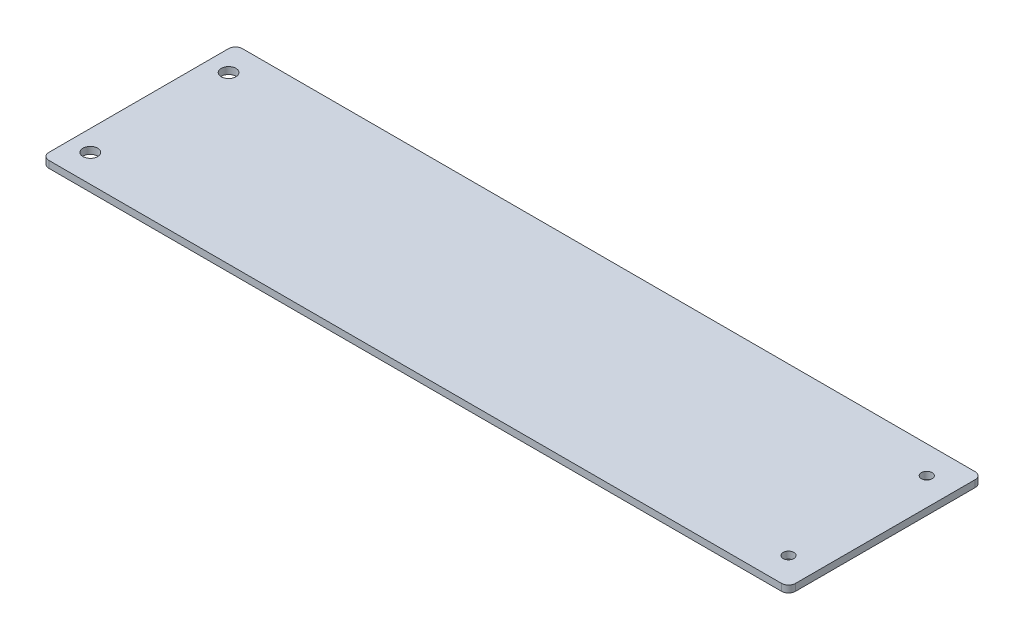
from build123d import *

# Parameters (mm, degrees)
SKETCH1_W                        = 342.9
SKETCH1_H                        = 88.9
BOSS_EXTRUDE1_DEPTH              = 3.175
F_17_64_0_26563_DIAMETER_HOLE1_D = 6.747002
F_10_0_1935_DIAMETER_HOLE1_D     = 4.9149
FILLET1_R                        = 3.175


with BuildPart() as part:
    # Sketch1 → Boss-Extrude1 (new body)
    with BuildSketch(Plane(origin=(0, 0, 0), x_dir=(1, 0, 0), z_dir=(0, 1, 0))):
        Rectangle(SKETCH1_W, SKETCH1_H)
    extrude(amount=BOSS_EXTRUDE1_DEPTH)

    # 17/64 (0.26563) Diameter Hole1 (through all)
    with Locations(Plane(origin=(0, 3.175, 0), x_dir=(1, 0, 0), z_dir=(0, 1, 0))):
        with Locations((-161.925, 31.75), (-161.925, -31.75)):
            Hole(F_17_64_0_26563_DIAMETER_HOLE1_D / 2)

    # #10 (0.1935) Diameter Hole1 (through all)
    with Locations(Plane(origin=(0, 3.175, 0), x_dir=(1, 0, 0), z_dir=(0, 1, 0))):
        with Locations((158.75, 31.75), (158.75, -31.75)):
            Hole(F_10_0_1935_DIAMETER_HOLE1_D / 2)

    # Fillet1
    fillet1_edges = [part.edges().sort_by_distance(p)[0] for p in [
        (171.45, 1.5875, 44.45),
        (-171.45, 1.5875, 44.45),
        (-171.45, 1.5875, -44.45),
        (171.45, 1.5875, -44.45),
    ]]
    fillet(fillet1_edges, radius=FILLET1_R)


solid = part.part
